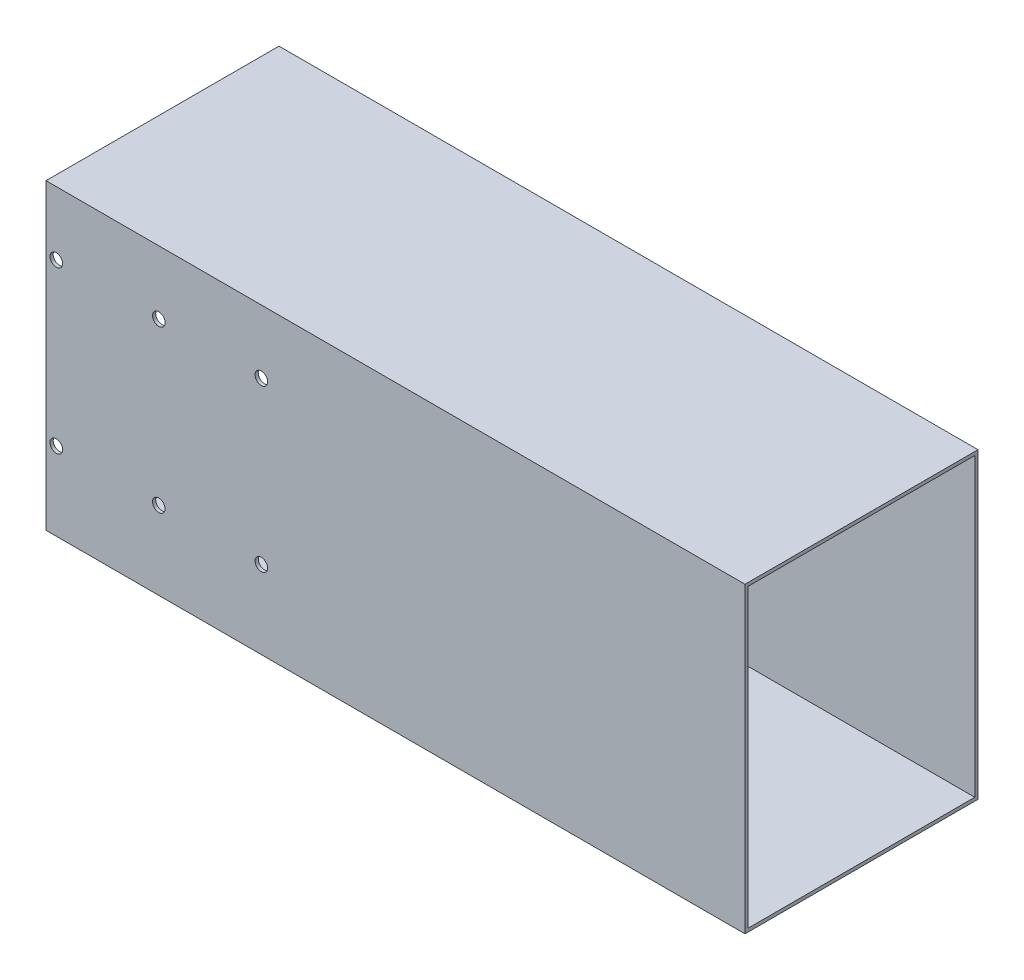
from build123d import *

# Parameters (mm, degrees)
ESBO_O1_W                = 150
ESBO_O1_H                = 50
ESBO_O1_R                = 1.35
RESSALTO_EXTRUS_O1_DEPTH = 50
ESBO_O5_W                = 150
ESBO_O5_H                = 14.978385154
RESSALTO_EXTRUS_O2_DEPTH = 50
ESBO_O6_W                = 48.634106334
ESBO_O6_H                = 63.528836918
CORTE_EXTRUS_O6_DEPTH    = 165.280193846


with BuildPart() as part:
    # Esboço1 → Ressalto-extrusão1 (new body)
    with BuildSketch(Plane.XY):
        with Locations((61.085582475, 19.586792778)):
            Rectangle(ESBO_O1_W, ESBO_O1_H)
        with Locations((-11.702376595, -3.638707723)):
            Circle(ESBO_O1_R, mode=Mode.SUBTRACT)
        with Locations((10.297623405, -3.638707723)):
            Circle(ESBO_O1_R, mode=Mode.SUBTRACT)
        with Locations((32.297623405, -3.638707723)):
            Circle(ESBO_O1_R, mode=Mode.SUBTRACT)
        with Locations(Location((32.297623405, 30.961292277, 0), (0, 0, 180))):
            Circle(ESBO_O1_R, mode=Mode.SUBTRACT)
        with Locations(Location((10.297623405, 30.961292277, 0), (0, 0, 180))):
            Circle(ESBO_O1_R, mode=Mode.SUBTRACT)
        with Locations(Location((-11.702376595, 30.961292277, 0), (0, 0, 180))):
            Circle(ESBO_O1_R, mode=Mode.SUBTRACT)
    extrude(amount=RESSALTO_EXTRUS_O1_DEPTH)

    # Esboço5 → Ressalto-extrusão2 (add)
    with BuildSketch(Plane.XY.offset(50)):
        with Locations((61.085582475, -12.902399799)):
            Rectangle(ESBO_O5_W, ESBO_O5_H)
    extrude(amount=-RESSALTO_EXTRUS_O2_DEPTH)

    # Esboço6 → Corte-extrusão6 (cut, through all)
    with BuildSketch(Plane.ZY.offset(13.914417525)):
        with Locations((25, 12.097600201)):
            Rectangle(ESBO_O6_W, ESBO_O6_H)
    extrude(amount=-CORTE_EXTRUS_O6_DEPTH, mode=Mode.SUBTRACT)


solid = part.part
